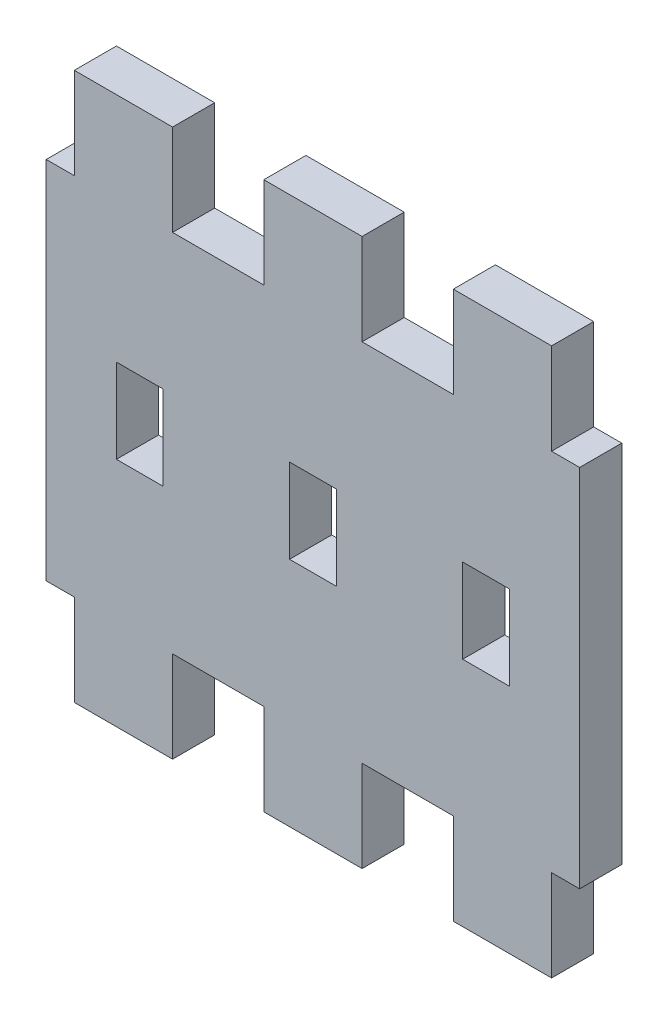
from build123d import *

# Parameters (mm, degrees)
SKETCH_1_W      = 3.333333333
SKETCH_1_H      = 6
SKETCH_1_W_2    = 3.333333334
EXTRUDE_1_DEPTH = 3


with BuildPart() as part:
    # 草图1 → 凸台-拉伸1 (new body)
    with BuildSketch(Plane.XY):
        Polygon((-17, 19.5), (-17, 13), (-19, 13), (-19, -13), (-17, -13), (-17, -19.5), (-10, -19.5), (-10, -13), (-3.5, -13), (-3.5, -19.5), (3.5, -19.5), (3.5, -13), (10, -13), (10, -19.5), (17, -19.5), (17, -13), (19, -13), (19, 13), (17, 13), (17, 19.5), (10, 19.5), (10, 13), (3.5, 13), (3.5, 19.5), (-3.5, 19.5), (-3.5, 13), (-10, 13), (-10, 19.5), align=None)
        with Locations((12.333333334, 0)):
            Rectangle(SKETCH_1_W, SKETCH_1_H, mode=Mode.SUBTRACT)
        with Locations((-12.333333334, 0)):
            Rectangle(SKETCH_1_W, SKETCH_1_H, mode=Mode.SUBTRACT)
        Rectangle(SKETCH_1_W_2, SKETCH_1_H, mode=Mode.SUBTRACT)
    extrude(amount=EXTRUDE_1_DEPTH)


solid = part.part
